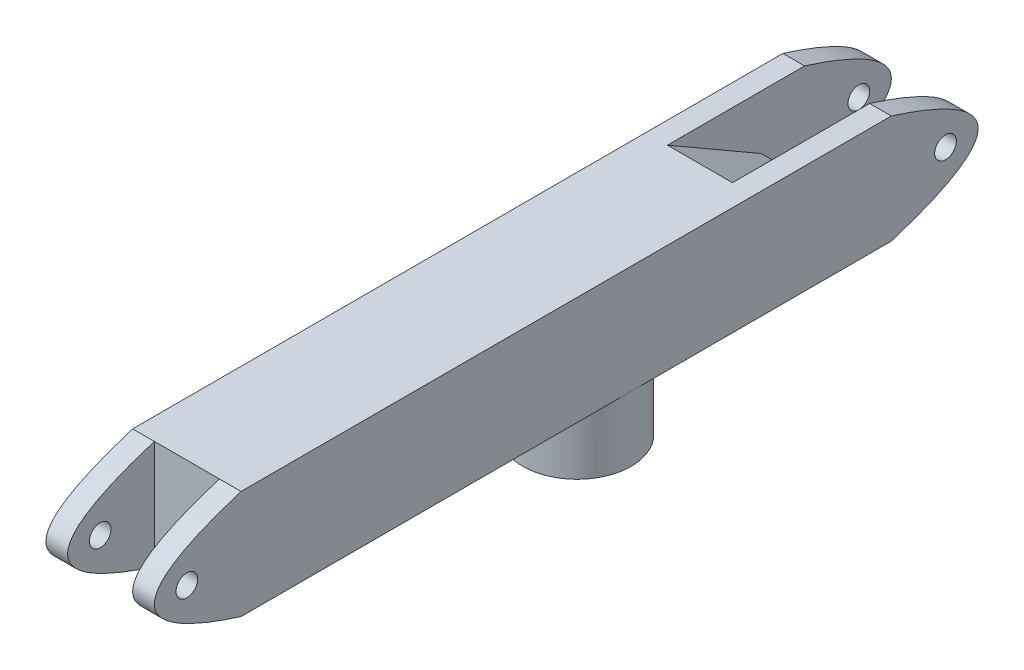
from build123d import *

# Parameters (mm, degrees)
SKETCH1_R               = 5
BOSS_EXTRUDE1_DEPTH     = 50
CUT_EXTRUDE1_DEPTH      = 52
CUT_EXTRUDE1_DEPTH_BACK = 35
SKETCH2_W               = 30
SKETCH2_H               = 60
SKETCH3_W               = 30
SKETCH3_H               = 40
CUT_EXTRUDE2_DEPTH      = 52
CUT_EXTRUDE3_START      = -10
CUT_EXTRUDE3_DEPTH      = 30
CUT_EXTRUDE4_START      = -10
CUT_EXTRUDE4_DEPTH      = 30
SKETCH6_R               = 25
BOSS_EXTRUDE2_DEPTH     = 30


with BuildPart() as part:
    # Sketch1 → Boss-Extrude1 (new body)
    with BuildSketch(Plane(origin=(0, 0, 0), x_dir=(0, 0, -1), z_dir=(1, 0, 0))):
        with BuildLine():
            Line((-255.87149894, 42.046001407), (44.12850106, 42.046001407))
            add(Edge.make_bspline(
                [(44.12850106, 42.046001407), (124.12850106, 17.046001407), (44.12850106, -7.953998593)],
                knots=[0, 0, 0, 1, 1, 1], degree=2))
            Line((44.12850106, -7.953998593), (-255.87149894, -7.953998593))
            add(Edge.make_bspline(
                [(-255.87149894, 42.046001407), (-335.87149894, 17.046001407), (-255.87149894, -7.953998593)],
                knots=[0, 0, 0, 1, 1, 1], degree=2))
        make_face()
        with Locations((-280.87149894, 17.046001407)):
            Circle(SKETCH1_R, mode=Mode.SUBTRACT)
        with Locations((69.12850106, 17.046001407)):
            Circle(SKETCH1_R, mode=Mode.SUBTRACT)
    extrude(amount=BOSS_EXTRUDE1_DEPTH)

    # Sketch2 → Cut-Extrude1 (cut, two sides: drawn at the far end of the back side and taken through both)
    with BuildSketch(Plane(origin=(0, 0, 0), x_dir=(1, 0, 0), z_dir=(0, 1, 0)).offset(-CUT_EXTRUDE1_DEPTH_BACK)):
        with Locations((25, 54.12850106)):
            Rectangle(SKETCH2_W, SKETCH2_H)
    extrude(amount=CUT_EXTRUDE1_DEPTH + CUT_EXTRUDE1_DEPTH_BACK, mode=Mode.SUBTRACT)

    # Sketch3 → Cut-Extrude2 (cut)
    with BuildSketch(Plane.XZ.offset(7.953998593)):
        with Locations((25, 275.87149894)):
            Rectangle(SKETCH3_W, SKETCH3_H)
    extrude(amount=-CUT_EXTRUDE2_DEPTH, mode=Mode.SUBTRACT)

    # Sketch4 → Cut-Extrude3 (cut)
    with BuildSketch(Plane.ZY.offset(CUT_EXTRUDE3_START)):
        Polygon((-24.12850106, 17.046001407), (-24.12850106, 42.046001407), (19.172769129, 42.046001407), align=None)
    extrude(amount=-CUT_EXTRUDE3_DEPTH, mode=Mode.SUBTRACT)

    # Sketch5 → Cut-Extrude4 (cut)
    with BuildSketch(Plane.ZY.offset(CUT_EXTRUDE4_START)):
        Polygon((-24.12850106, -7.953998593), (-24.12850106, 17.046001407), (19.172769129, -7.953998593), align=None)
    extrude(amount=-CUT_EXTRUDE4_DEPTH, mode=Mode.SUBTRACT)

    # Sketch6 → Boss-Extrude2 (add)
    with BuildSketch(Plane.XZ.offset(7.953998593)):
        with Locations(Location((25, 75.87149894, 0), (0, 0, 180))):
            Circle(SKETCH6_R)
    extrude(amount=BOSS_EXTRUDE2_DEPTH)


solid = part.part
